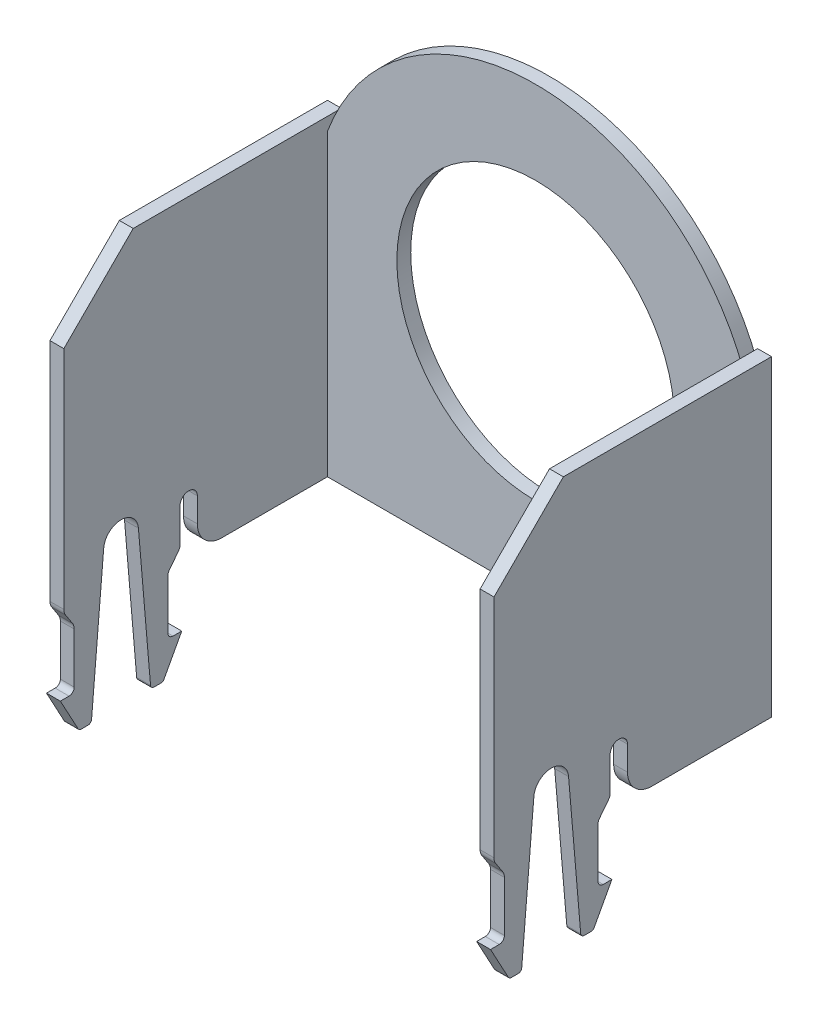
from build123d import *

# Parameters (mm, degrees)
DODANIE_WYCI_GNI_CIE1_DEPTH = 0.4
WYTNIJ_WYCI_GNI_CIE1_REACH  = 11.06
SZKIC6_R                    = 4
DODANIE_WYCI_GNI_CIE4_DEPTH = 0.4


with BuildPart() as part:
    # Szkic1 → Dodanie-wyciągnięcie1 (new body)
    with BuildSketch(Plane.XY):
        with BuildLine():
            Line((0, -6.4), (6.4, -6.4))
            Line((6.4, -6.4), (6.4, 0))
            ThreePointArc((6.4, 0), (0, 6.4), (-6.4, 0))
            Line((-6.4, 0), (-6.4, -6.4))
            Line((-6.4, -6.4), (0, -6.4))
        make_face()
    extrude(amount=DODANIE_WYCI_GNI_CIE1_DEPTH)

    # Szkic6 → Wytnij-wyciągnięcie1 (cut, up to next)
    with BuildSketch(Plane.XY.offset(0.4), mode=Mode.PRIVATE) as wytnij_wyci_gni_cie1_sk1:
        Circle(SZKIC6_R)
    wytnij_wyci_gni_cie1_tool1 = extrude(wytnij_wyci_gni_cie1_sk1.sketch, amount=-WYTNIJ_WYCI_GNI_CIE1_REACH, mode=Mode.PRIVATE) & part.part
    add(wytnij_wyci_gni_cie1_tool1.solids().sort_by_distance((0, 0, 0.4))[0], mode=Mode.SUBTRACT)

    # Szkic5 → Dodanie-wyciągnięcie4 (add)
    with BuildSketch(Plane.ZY.offset(6.4)):
        with BuildLine():
            Line((5.000724361, -6.56862155), (5.000724361, -8))
            ThreePointArc((5.000724361, -8), (4.956790379, -8.106066017), (4.850724361, -8.15))
            Line((4.850724361, -8.15), (4.600724361, -8.15))
            Line((4.600724361, -8.15), (5.112747467, -9.097540152))
            ThreePointArc((5.112747467, -9.097540152), (5.149509203, -9.135889508), (5.200724361, -9.15))
            Line((5.200724361, -9.15), (5.400724361, -9.15))
            ThreePointArc((5.400724361, -9.15), (5.468361913, -9.123655697), (5.500362181, -9.058503233))
            Line((5.500362181, -9.058503233), (5.850362181, -4.957329291))
            ThreePointArc((5.850362181, -4.957329291), (6.350362181, -4.498182514), (6.850362181, -4.957329291))
            Line((6.850362181, -4.957329291), (7.200362181, -9.058503233))
            ThreePointArc((7.200362181, -9.058503233), (7.232362449, -9.123655697), (7.3, -9.15))
            Line((7.3, -9.15), (7.5, -9.15))
            ThreePointArc((7.5, -9.15), (7.551215158, -9.135889508), (7.587976894, -9.097540152))
            Line((7.587976894, -9.097540152), (8.1, -8.15))
            Line((8.1, -8.15), (7.85, -8.15))
            ThreePointArc((7.85, -8.15), (7.743933983, -8.106066017), (7.7, -8))
            Line((7.7, -8), (7.7, -6.55))
            ThreePointArc((7.7, -6.55), (7.712395552, -6.464655511), (7.748557878, -6.386363636))
            Line((7.748557878, -6.386363636), (7.951442122, -6.074613587))
            ThreePointArc((7.951442122, -6.074613587), (7.987604448, -5.996321712), (8, -5.910977223))
            Line((8, -5.910977223), (8, 0.6))
            Line((8, 0.6), (6, 2.6))
            Line((6, 2.6), (0, 2.6))
            Line((0, 2.6), (0, -6.4))
            Line((0, -6.4), (3.450724361, -6.4))
            ThreePointArc((3.450724361, -6.4), (3.945699108, -6.194974747), (4.150724361, -5.7))
            Line((4.150724361, -5.7), (4.150724361, -5))
            ThreePointArc((4.150724361, -5), (4.400724361, -4.75), (4.650724361, -5))
            Line((4.650724361, -5), (4.650724361, -5.98137845))
            ThreePointArc((4.650724361, -5.98137845), (4.661549722, -6.046285735), (4.692853918, -6.104166573))
            Line((4.692853918, -6.104166573), (4.958594805, -6.445833427))
            ThreePointArc((4.958594805, -6.445833427), (4.989899001, -6.503714265), (5.000724361, -6.56862155))
        make_face()
    dodanie_wyci_gni_cie4 = extrude(amount=-DODANIE_WYCI_GNI_CIE4_DEPTH)

    # Lustro1: Dodanie-wyciągnięcie4 across plane
    add(dodanie_wyci_gni_cie4.mirror(Plane(origin=(0, 0, 0), x_dir=(0, 0, 1), z_dir=(1, 0, 0))))


solid = part.part
